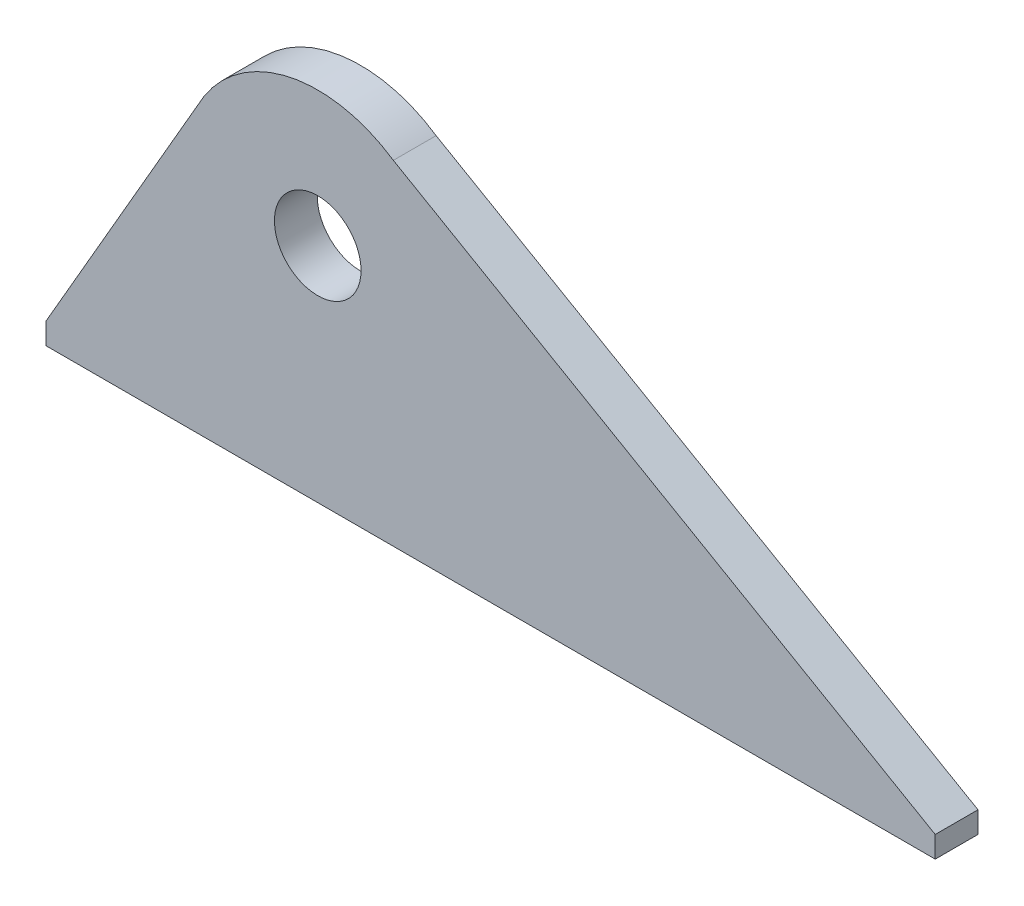
from build123d import *

# Parameters (mm, degrees)
ESQUISSE1_R        = 10.125
BOSS_EXTRU_1_DEPTH = 10


with BuildPart() as part:
    # Esquisse1 → Boss.-Extru.1 (new body)
    with BuildSketch(Plane.XY):
        with BuildLine():
            Line((0, 0), (207.878588044, 0))
            Line((207.878588044, 0), (207.878588044, 5))
            Line((207.878588044, 5), (81.20130317, 78.137164522))
            ThreePointArc((81.20130317, 78.137164522), (57.130536246, 82.902959743), (36.932524958, 68.969009678))
            Line((36.932524958, 68.969009678), (0, 5))
            Line((0, 5), (0, 0))
        make_face()
        with Locations((63.524775179, 52.028138149)):
            Circle(ESQUISSE1_R, mode=Mode.SUBTRACT)
    extrude(amount=BOSS_EXTRU_1_DEPTH)


solid = part.part
